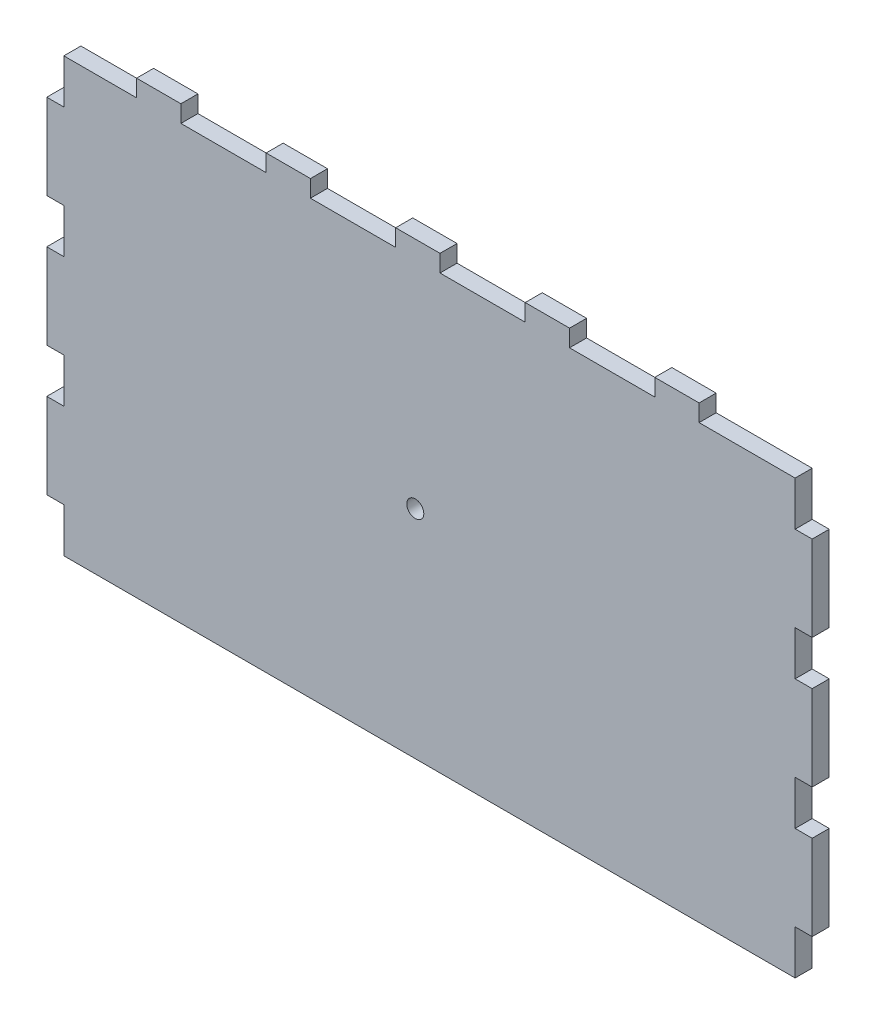
from build123d import *

# Parameters (mm, degrees)
SKETCH1_W                       = 134.7
SKETCH1_H                       = 76.2
BOSS_EXTRUDE1_DEPTH             = 3
SKETCH2_W                       = 3
SKETCH2_H                       = 7.8
CUT_EXTRUDE1_DEPTH              = 78.437926754
LPATTERN1_COUNT                 = 4
LPATTERN1_PITCH                 = 22.8
F_3_0MM_CLEARANCE_DOWEL_HOLE1_D = 3
MIRROR4_COPY_1_SKETCH_W         = 3
MIRROR4_COPY_1_SKETCH_H         = 7.8
MIRROR4_COPY_1_DEPTH            = 78.437926754
MIRROR4_COPY_2_SKETCH_W         = 3
MIRROR4_COPY_2_SKETCH_H         = 7.8
MIRROR4_COPY_2_DEPTH            = 78.437926754
MIRROR4_COPY_3_SKETCH_W         = 3
MIRROR4_COPY_3_SKETCH_H         = 7.8
MIRROR4_COPY_3_DEPTH            = 78.437926754
SKETCH5_W                       = 7.8
SKETCH5_H                       = 3
BOSS_EXTRUDE2_DEPTH             = 3
LPATTERN2_COUNT                 = 5
LPATTERN2_PITCH                 = 22.8


with BuildPart() as part:
    # Sketch1 → Boss-Extrude1 (new body)
    with BuildSketch(Plane.XY):
        Rectangle(SKETCH1_W, SKETCH1_H)
    extrude(amount=BOSS_EXTRUDE1_DEPTH)

    # Sketch2 → Cut-Extrude1 (cut, through all)
    with BuildSketch(Plane.XY.offset(3)):
        with Locations((-65.85, 34.2)):
            Rectangle(SKETCH2_W, SKETCH2_H)
    cut_extrude1 = extrude(amount=-CUT_EXTRUDE1_DEPTH, mode=Mode.SUBTRACT)

    # LPattern1: Cut-Extrude1 ×4
    with Locations(*[(0, -i * LPATTERN1_PITCH, 0) for i in range(1, LPATTERN1_COUNT)]):
        add(cut_extrude1, mode=Mode.SUBTRACT)

    # Ø3.0mm Clearance Dowel Hole1 (through all)
    with Locations(Plane.XY.offset(3)):
        with Locations((-2.5, 0)):
            Hole(F_3_0MM_CLEARANCE_DOWEL_HOLE1_D / 2)

    # Mirror4: Cut-Extrude1 across plane
    add(cut_extrude1.mirror(Plane(origin=(0, 0, 0), x_dir=(0, 0, 1), z_dir=(1, 0, 0))), mode=Mode.SUBTRACT)

    # Mirror4 copy 1 sketch → Mirror4 copy 1 (cut, through all)
    with BuildSketch(Plane(origin=(0, -22.8, 3), x_dir=(-1, 0, 0), z_dir=(0, 0, 1))):
        with Locations((-65.85, -34.2)):
            Rectangle(MIRROR4_COPY_1_SKETCH_W, MIRROR4_COPY_1_SKETCH_H)
    extrude(amount=-MIRROR4_COPY_1_DEPTH, mode=Mode.SUBTRACT)

    # Mirror4 copy 2 sketch → Mirror4 copy 2 (cut, through all)
    with BuildSketch(Plane(origin=(0, -45.6, 3), x_dir=(-1, 0, 0), z_dir=(0, 0, 1))):
        with Locations((-65.85, -34.2)):
            Rectangle(MIRROR4_COPY_2_SKETCH_W, MIRROR4_COPY_2_SKETCH_H)
    extrude(amount=-MIRROR4_COPY_2_DEPTH, mode=Mode.SUBTRACT)

    # Mirror4 copy 3 sketch → Mirror4 copy 3 (cut, through all)
    with BuildSketch(Plane(origin=(0, -68.4, 3), x_dir=(-1, 0, 0), z_dir=(0, 0, 1))):
        with Locations((-65.85, -34.2)):
            Rectangle(MIRROR4_COPY_3_SKETCH_W, MIRROR4_COPY_3_SKETCH_H)
    extrude(amount=-MIRROR4_COPY_3_DEPTH, mode=Mode.SUBTRACT)

    # Sketch5 → Boss-Extrude2 (add)
    with BuildSketch(Plane(origin=(0, 38.1, 0), x_dir=(1, 0, 0), z_dir=(0, 1, 0))):
        with Locations((-47.65, -1.5)):
            Rectangle(SKETCH5_W, SKETCH5_H)
    boss_extrude2 = extrude(amount=BOSS_EXTRUDE2_DEPTH)

    # LPattern2: Boss-Extrude2 ×5
    with Locations(*[(i * LPATTERN2_PITCH, 0, 0) for i in range(1, LPATTERN2_COUNT)]):
        add(boss_extrude2)


solid = part.part
